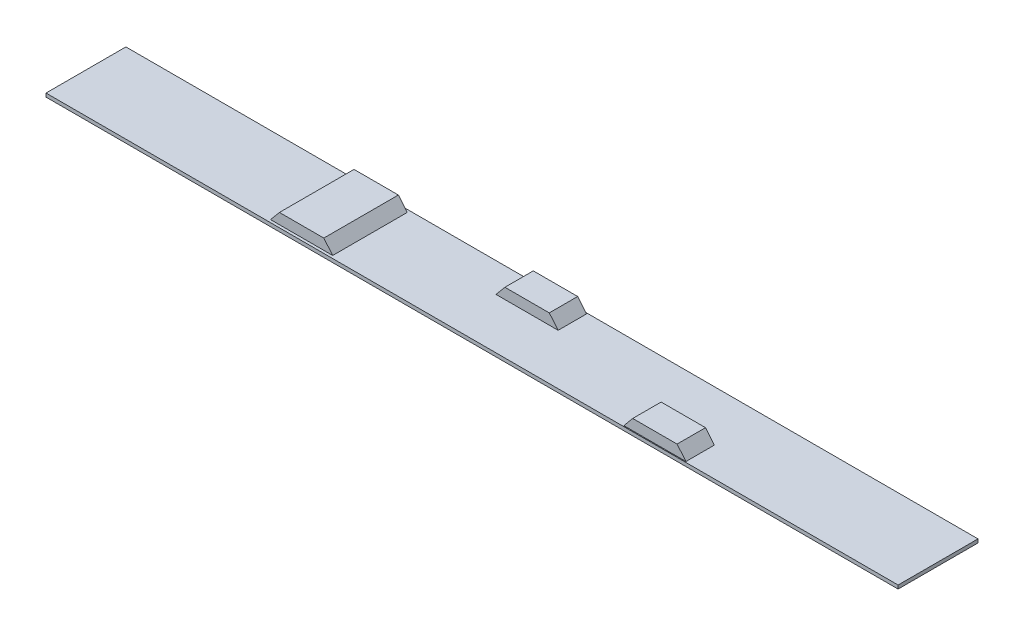
from build123d import *

# Parameters (mm, degrees)
SKETCH1_W                = 2400
SKETCH1_H                = 225
BOSS_EXTRUDE1_DEPTH      = 10
BOSS_EXTRUDE2_START      = 30
BOSS_EXTRUDE2_DEPTH      = 80
BOSS_EXTRUDE4_START      = -30
BOSS_EXTRUDE4_DEPTH      = 80
BOSS_EXTRUDE5_DEPTH      = 105
BOSS_EXTRUDE5_DEPTH_BACK = 105


with BuildPart() as part:
    # Sketch1 → Boss-Extrude1 (new body)
    with BuildSketch(Plane(origin=(0, 0, 0), x_dir=(1, 0, 0), z_dir=(0, 1, 0))):
        Rectangle(SKETCH1_W, SKETCH1_H)
    extrude(amount=BOSS_EXTRUDE1_DEPTH)

    # Sketch2 → Boss-Extrude2 (add)
    with BuildSketch(Plane.XY.offset(BOSS_EXTRUDE2_START)):
        Polygon((425, 10), (450, 40), (575, 40), (600, 10), align=None)
    extrude(amount=BOSS_EXTRUDE2_DEPTH)

    # Sketch3 → Boss-Extrude4 (add)
    with BuildSketch(Plane.XY.offset(BOSS_EXTRUDE4_START)):
        Polygon((100, 10), (75, 40), (-50, 40), (-75, 10), align=None)
    extrude(amount=-BOSS_EXTRUDE4_DEPTH)

    # Sketch5 → Boss-Extrude5 (add, two sides: drawn at the far end of the back side and taken through both)
    with BuildSketch(Plane.XY.offset(-BOSS_EXTRUDE5_DEPTH_BACK)):
        Polygon((-550, 40), (-575, 10), (-400, 10), (-425, 40), align=None)
    extrude(amount=BOSS_EXTRUDE5_DEPTH + BOSS_EXTRUDE5_DEPTH_BACK)


solid = part.part
